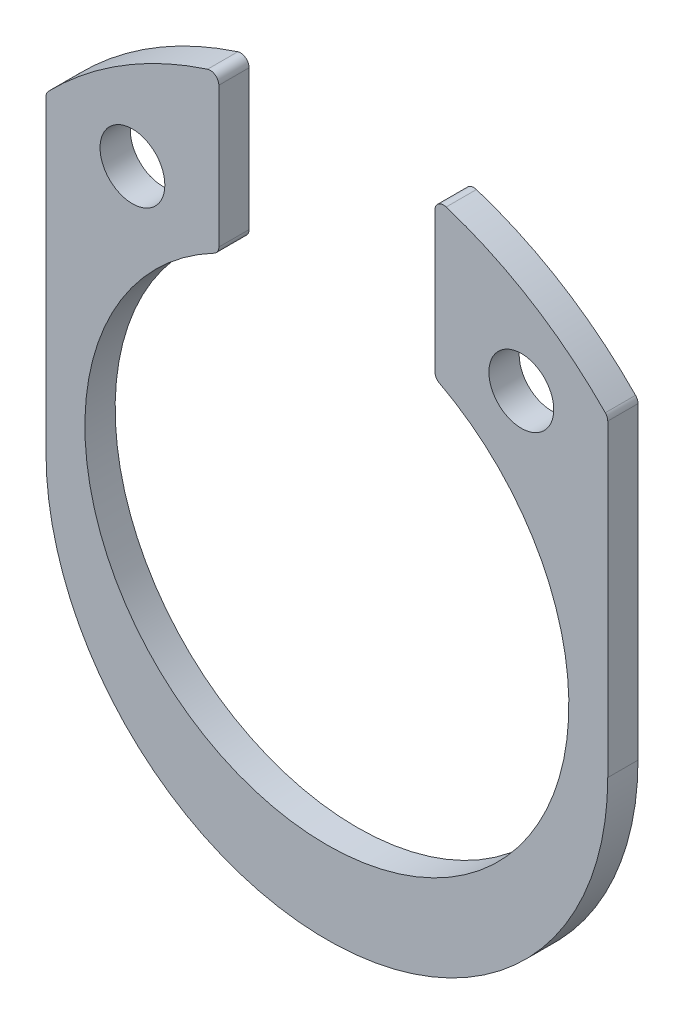
from build123d import *

# Parameters (mm, degrees)
ESQUISSE1_R      = 0.75
EXTRUSION1_DEPTH = 0.7


with BuildPart() as part:
    # Esquisse1 → Extrusion1 (new body)
    with BuildSketch(Plane.XY):
        with BuildLine():
            Line((-6.5, -1), (-6.5, 6.144102864))
            ThreePointArc((-6.5, 6.144102864), (-6.485251672, 6.2194807), (-6.443181818, 6.283741565))
            ThreePointArc((-6.443181818, 6.283741565), (-4.741623269, 7.649641088), (-2.761363636, 8.565913312))
            ThreePointArc((-2.761363636, 8.565913312), (-2.582256056, 8.53722713), (-2.5, 8.375559683))
            Line((-2.5, 8.375559683), (-2.5, 5.133225107))
            ThreePointArc((-2.5, 5.133225107), (-2.528797357, 5.029834318), (-2.606896552, 4.956217345))
            ThreePointArc((-2.606896552, 4.956217345), (0, -5.6), (2.606896552, 4.956217345))
            ThreePointArc((2.606896552, 4.956217345), (2.528797357, 5.029834318), (2.5, 5.133225107))
            Line((2.5, 5.133225107), (2.5, 8.375559683))
            ThreePointArc((2.5, 8.375559683), (2.582256056, 8.53722713), (2.761363636, 8.565913312))
            ThreePointArc((2.761363636, 8.565913312), (4.741623269, 7.649641088), (6.443181818, 6.283741565))
            ThreePointArc((6.443181818, 6.283741565), (6.485251672, 6.2194807), (6.5, 6.144102864))
            Line((6.5, 6.144102864), (6.5, -1))
            ThreePointArc((6.5, -1), (0, -7.5), (-6.5, -1))
        make_face()
        with Locations((-4.5, 5.75)):
            Circle(ESQUISSE1_R, mode=Mode.SUBTRACT)
        with Locations((4.5, 5.75)):
            Circle(ESQUISSE1_R, mode=Mode.SUBTRACT)
    extrude(amount=EXTRUSION1_DEPTH)


solid = part.part
